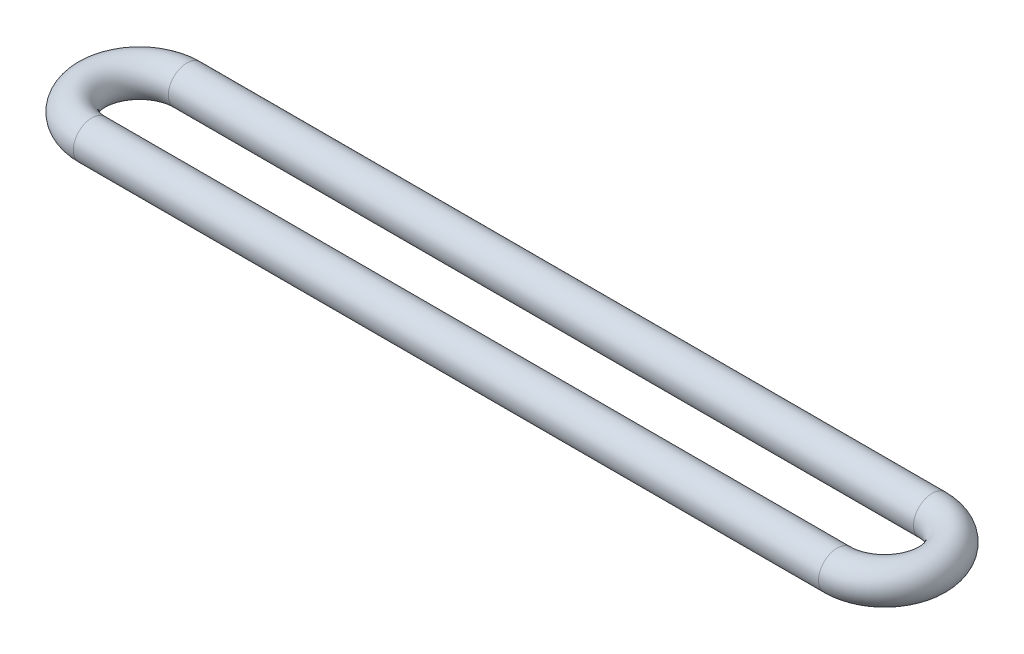
from build123d import *

# Parameters (mm, degrees)
SKETCH2_R = 1


with BuildPart() as part:
    # Sweep1: sweep along a path in Sketch1
    with BuildLine(Plane(origin=(0, 0, 0), x_dir=(1, 0, 0), z_dir=(0, 1, 0))) as sweep1_path:
        Line((0, 0), (40, 0))
        ThreePointArc((40, 0), (42.55, -2.55), (40, -5.1))
        Line((40, -5.1), (0, -5.1))
        ThreePointArc((0, -5.1), (-2.55, -2.55), (0, 0))
    # Sketch2 → Sweep1 (sweep)
    with BuildSketch(Plane(origin=(0, 0, 0), x_dir=(0, 0, -1), z_dir=(1, 0, 0))):
        Circle(SKETCH2_R)
    sweep(path=sweep1_path.line)


solid = part.part
